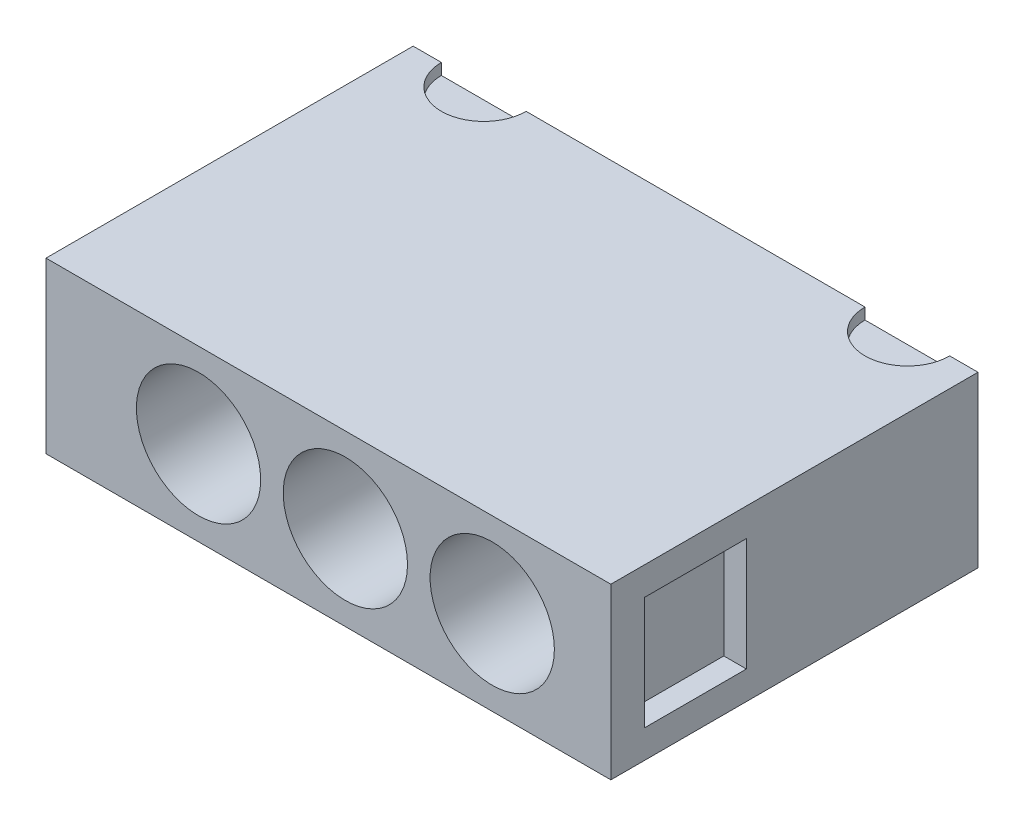
from build123d import *

# Parameters (mm, degrees)
SKETCH3_W           = 1000
SKETCH3_H           = 300
BOSS_EXTRUDE2_DEPTH = 650
SKETCH4_W           = 180
SKETCH4_H           = 200
CUT_EXTRUDE2_DEPTH  = 40
SKETCH5_W           = 200
SKETCH5_H           = 220
CUT_EXTRUDE3_DEPTH  = 650
SKETCH9_R           = 110
CUT_EXTRUDE4_DEPTH  = 500
CUT_EXTRUDE6_DEPTH  = 20
CUT_EXTRUDE7_START  = -20
CUT_EXTRUDE7_DEPTH  = 20
BOSS_EXTRUDE5_START = -36
BOSS_EXTRUDE5_DEPTH = 36


with BuildPart() as part:
    # Sketch3 → Boss-Extrude2 (new body)
    with BuildSketch(Plane.XY):
        with Locations((500, 150)):
            Rectangle(SKETCH3_W, SKETCH3_H)
    extrude(amount=BOSS_EXTRUDE2_DEPTH)

    # Sketch4 → Cut-Extrude2 (cut)
    with BuildSketch(Plane(origin=(1000, 0, 0), x_dir=(0, 0, -1), z_dir=(1, 0, 0))):
        with Locations((-500, 150)):
            Rectangle(SKETCH4_W, SKETCH4_H)
    extrude(amount=-CUT_EXTRUDE2_DEPTH, mode=Mode.SUBTRACT)

    # Sketch5 → Cut-Extrude3 (cut)
    with BuildSketch(Plane.ZY):
        with Locations((130, 150)):
            Rectangle(SKETCH5_W, SKETCH5_H)
    extrude(amount=-CUT_EXTRUDE3_DEPTH, mode=Mode.SUBTRACT)

    # Sketch9 → Cut-Extrude4 (cut)
    with BuildSketch(Plane.XY.offset(650)):
        with Locations((270, 150)):
            Circle(SKETCH9_R)
        with Locations((530, 150)):
            Circle(SKETCH9_R)
        with Locations((790, 150)):
            Circle(SKETCH9_R)
    extrude(amount=-CUT_EXTRUDE4_DEPTH, mode=Mode.SUBTRACT)

    # Sketch16 → Cut-Extrude6 (cut)
    with BuildSketch(Plane(origin=(0, 300, 0), x_dir=(1, 0, 0), z_dir=(0, 1, 0))):
        with BuildLine():
            Line((50, 0), (200, 0))
            ThreePointArc((200, 0), (125, -75), (50, 0))
        make_face()
        with BuildLine():
            Line((800, 0), (950, 0))
            ThreePointArc((950, 0), (875, -75), (800, 0))
        make_face()
    extrude(amount=-CUT_EXTRUDE6_DEPTH, mode=Mode.SUBTRACT)

    # Sketch17 → Cut-Extrude7 (cut)
    with BuildSketch(Plane.XZ.offset(CUT_EXTRUDE7_START)):
        with BuildLine():
            Line((950, 0), (800, 0))
            ThreePointArc((800, 0), (875, 75), (950, 0))
        make_face()
        with BuildLine():
            Line((200, 0), (50, 0))
            ThreePointArc((50, 0), (125, 75), (200, 0))
        make_face()
    extrude(amount=CUT_EXTRUDE7_DEPTH, mode=Mode.SUBTRACT)

    # Sketch20 → Boss-Extrude5 (add)
    with BuildSketch(Plane(origin=(0, 0, 230), x_dir=(-1, 0, 0), z_dir=(0, 0, -1)).offset(BOSS_EXTRUDE5_START)):
        with BuildLine():
            Line((-262.20422396, 248.292446323), (-379.977728565, 152.213418103))
            ThreePointArc((-379.977728565, 152.213418103), (-379.258383778, 137.248310924), (-376.512143463, 122.519765376))
            Line((-376.512143463, 122.519765376), (-262.20422396, 248.292446323))
        make_face()
        with BuildLine():
            Line((-211.268579762, 222.638299571), (-339.161275259, 64.462183775))
            ThreePointArc((-339.161275259, 64.462183775), (-320.720059896, 52.39121185), (-300.242552389, 44.239005181))
            Line((-300.242552389, 44.239005181), (-211.268579762, 222.638299571))
        make_face()
        Polygon((-636.02165018, 120.684309778), (-579.382132355, 248.292446323), (-490.67938588, 224.867424015), align=None)
        Polygon((-442.968214146, 145.394183969), (-625.077752353, 73.624220022), (-590, 40), align=None)
    extrude(amount=BOSS_EXTRUDE5_DEPTH)


with BuildPart() as boss_extrude5_piece_1:
    # of the separate pieces the step leaves, piece 1, a body of its own (boss_extrude5_pieces)
    add(part.part.solids().sort_by_distance((0, 300, 0))[0])


with BuildPart() as boss_extrude5_piece_2:
    # of the separate pieces the step leaves, piece 2, a body of its own (boss_extrude5_pieces)
    add(part.part.solids().sort_by_distance((490.67938588, 224.867424015, 230))[0])


solid = Compound([boss_extrude5_piece_1.part, boss_extrude5_piece_2.part])
